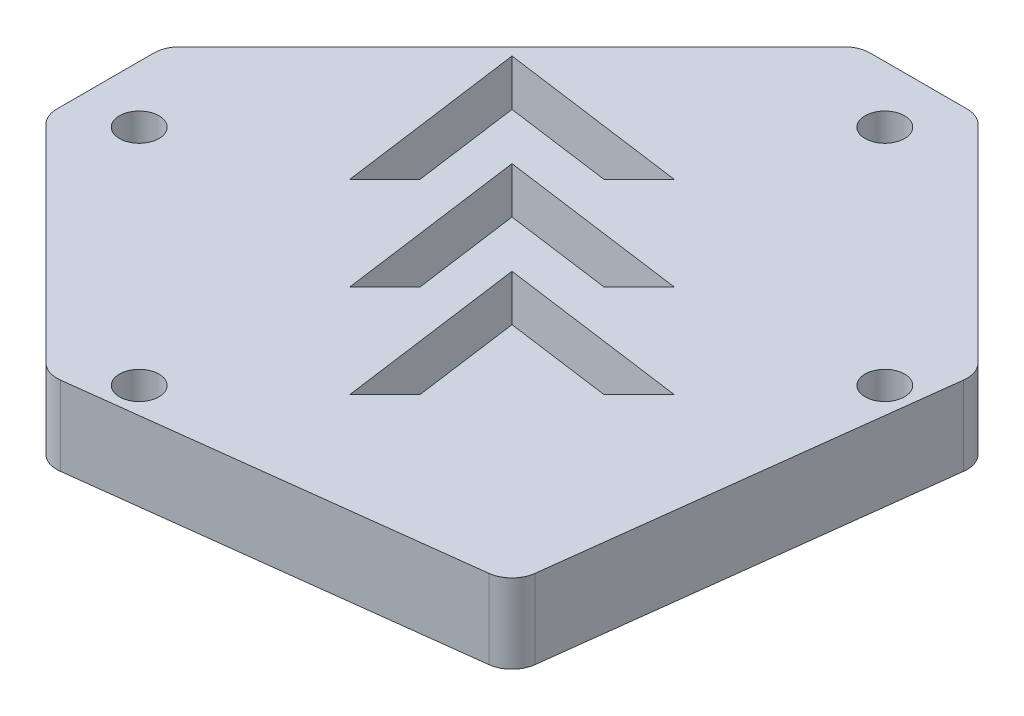
from build123d import *

# Parameters (mm, degrees)
SKETCH_1_W          = 60
SKETCH_1_H          = 65
EXTRUDE_1_DEPTH     = 6
SKETCH_4_R          = 1.5
CUT_EXTRUDE_1_DEPTH = 8
CUT_EXTRUDE_2_DEPTH = 8
SKETCH_7_R          = 1.5
CUT_EXTRUDE_3_DEPTH = 8
SKETCH_8_R          = 1.5
CUT_EXTRUDE_4_DEPTH = 10
FILLET_1_R          = 2


with BuildPart() as part:
    # 草图1 → 凸台-拉伸1 (new body)
    with BuildSketch(Plane(origin=(0, 0, 0), x_dir=(1, 0, 0), z_dir=(0, 1, 0))):
        Rectangle(SKETCH_1_W, SKETCH_1_H)
    extrude(amount=EXTRUDE_1_DEPTH)

    # 草图4 → 切除-拉伸1 (cut)
    with BuildSketch(Plane(origin=(0, 6, 0), x_dir=(1, 0, 0), z_dir=(0, 1, 0))):
        with Locations(Location((-19.60951637, -0.101604527, 0), (0, 0, 270))):
            Circle(SKETCH_4_R)
        with Locations(Location((8.674754878, 28.18266672, 0), (0, 0, 270))):
            Circle(SKETCH_4_R)
        with Locations(Location((-2.638953621, -17.072167276, 0), (0, 0, 270))):
            Circle(SKETCH_4_R)
        with Locations(Location((25.645317626, 11.212103971, 0), (0, 0, 270))):
            Circle(SKETCH_4_R)
    extrude(amount=-CUT_EXTRUDE_1_DEPTH, mode=Mode.SUBTRACT)

    # 草图5 → 切除-拉伸2 (cut)
    with BuildSketch(Plane(origin=(0, 6, 0), x_dir=(1, 0, 0), z_dir=(0, 1, 0))):
        Polygon((-10.140132024, 18.713282374), (-8.189895494, 4.450031542), (-5.526194118, 7.113732918), (-6.63263276, 15.205783111), (1.459417432, 14.099344468), (4.123118808, 16.763045844), align=None)
        Polygon((11.19418662, 9.691978032), (-3.069064212, 11.642214563), (-1.118827682, -2.621036269), (1.544873694, 0.042665106), (0.438435051, 8.134715299), (8.530485244, 7.028276656), align=None)
        Polygon((18.265254432, 2.62091022), (4.0020036, 4.571146751), (5.95224013, -9.692104081), (8.615941506, -7.028402705), (7.509502863, 1.063647487), (15.601553056, -0.042791156), align=None)
    extrude(amount=-CUT_EXTRUDE_2_DEPTH, mode=Mode.SUBTRACT)

    # 草图7 → 切除-拉伸3 (cut)
    with BuildSketch(Plane(origin=(0, 6, 0), x_dir=(1, 0, 0), z_dir=(0, 1, 0))):
        with Locations(Location((-21, -24.5, 0), (0, 0, 270))):
            Circle(SKETCH_7_R)
        with Locations(Location((-21, -16.5, 0), (0, 0, 270))):
            Circle(SKETCH_7_R)
        with Locations(Location((-21, 24.5, 0), (0, 0, 270))):
            Circle(SKETCH_7_R)
        with Locations(Location((-21, 16.5, 0), (0, 0, 270))):
            Circle(SKETCH_7_R)
    extrude(amount=-CUT_EXTRUDE_3_DEPTH, mode=Mode.SUBTRACT)

    # 草图8 → 切除-拉伸4 (cut)
    with BuildSketch(Plane(origin=(0, 6, 0), x_dir=(1, 0, 0), z_dir=(0, 1, 0))):
        Polygon((30, 32.5), (11.42848941, 32.5), (28.399052158, 15.529437252), (24.532691742, -15.959541392), (-6.956286901, -19.825901808), (-23.92684965, -2.855339059), (-23.92684965, 6.144660941), (2.42848941, 32.5), (-30, 32.5), (-30, -32.5), (30, -32.5), align=None)
        with Locations((-21, -24.5)):
            Circle(SKETCH_8_R, mode=Mode.SUBTRACT)
        with Locations((-21, -16.5)):
            Circle(SKETCH_8_R, mode=Mode.SUBTRACT)
        with Locations((-21, 16.5)):
            Circle(SKETCH_8_R, mode=Mode.SUBTRACT)
        with Locations((-21, 24.5)):
            Circle(SKETCH_8_R, mode=Mode.SUBTRACT)
    extrude(amount=-CUT_EXTRUDE_4_DEPTH, mode=Mode.SUBTRACT)

    # 圆角1
    fillet_1_edges = [part.edges().sort_by_distance(p)[0] for p in [
        (2.42848941, 3, -32.5),
        (-23.92684965, 3, -6.144660941),
        (-23.92684965, 3, 2.855339059),
        (-6.956286901, 3, 19.825901808),
        (24.532691742, 3, 15.959541392),
        (28.399052158, 3, -15.529437252),
        (11.42848941, 3, -32.5),
    ]]
    fillet(fillet_1_edges, radius=FILLET_1_R)


solid = part.part
